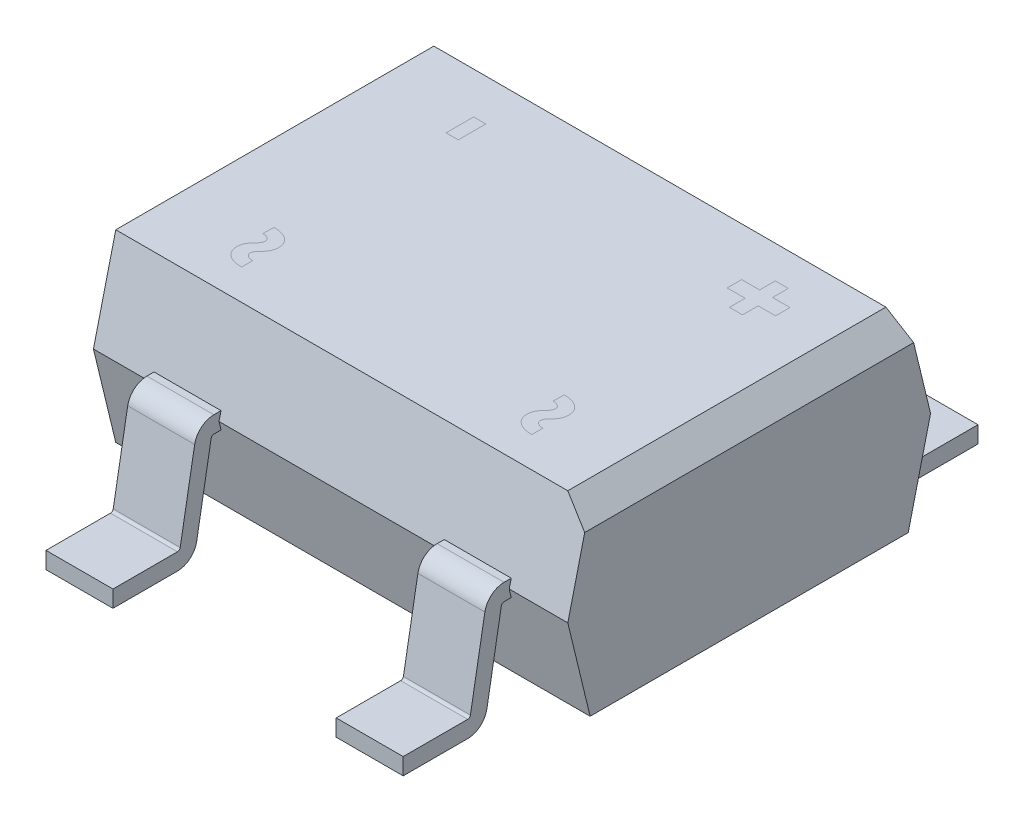
from build123d import *

# Parameters (mm, degrees)
BOSS_EXTRUDE1_DEPTH = 4.25
CHAMFER1_SIZE       = 0.4
BOSS_EXTRUDE2_DEPTH = 0.6
LPATTERN1_COUNT     = 2
LPATTERN1_PITCH     = 5.2


with BuildPart() as part:
    # Sketch1 → Boss-Extrude1 (new, symmetric)
    with BuildSketch(Plane(origin=(0, 0, 0), x_dir=(0, 0, -1), z_dir=(1, 0, 0))):
        Polygon((2.85, 0.3), (-2.85, 0.3), (-3.25, 1.95), (-2.85, 3.6), (2.85, 3.6), (3.25, 1.95), align=None)
    extrude(amount=BOSS_EXTRUDE1_DEPTH, both=True)

    # Chamfer1
    chamfer1_edges = [part.edges().sort_by_distance(p)[0] for p in [
        (4.25, 3.6, 0),
    ]]
    chamfer(chamfer1_edges, length=CHAMFER1_SIZE)


with BuildPart() as body_2:
    # Sketch2 → Boss-Extrude2 (new, symmetric)
    with BuildSketch(Plane(origin=(2.6, 0, 0), x_dir=(0, 0, -1), z_dir=(1, 0, 0))):
        with BuildLine():
            Line((5.15, 0), (3.994682714, 0))
            ThreePointArc((3.994682714, 0), (3.76970705, 0.081884445), (3.65, 0.289223138))
            Line((3.65, 0.289223138), (3.390894683, 1.758682409))
            ThreePointArc((3.390894683, 1.758682409), (3.373793676, 1.788302222), (3.341654296, 1.8))
            Line((3.341654296, 1.8), (2.841654296, 1.8))
            Line((2.841654296, 1.8), (2.841654296, 2.1))
            Line((2.841654296, 2.1), (3.341654296, 2.1))
            ThreePointArc((3.341654296, 2.1), (3.566629959, 2.018115555), (3.686337009, 1.810776862))
            Line((3.686337009, 1.810776862), (3.945442326, 0.341317591))
            ThreePointArc((3.945442326, 0.341317591), (3.962543333, 0.311697778), (3.994682714, 0.3))
            Line((3.994682714, 0.3), (5.15, 0.3))
            Line((5.15, 0.3), (5.15, 0))
        make_face()
    boss_extrude2 = extrude(amount=BOSS_EXTRUDE2_DEPTH, both=True)


with BuildPart() as lpattern1_1:
    # LPattern1: Boss-Extrude2 ×2
    with Locations(*[(-i * LPATTERN1_PITCH, 0, 0) for i in range(1, LPATTERN1_COUNT)]):
        add(boss_extrude2)


with BuildPart() as body_4:
    # Mirror2: mirrored copy
    add(body_2.part.mirror(Plane.XY))


with BuildPart() as body_5:
    # Mirror2 2: mirrored copy
    add(lpattern1_1.part.mirror(Plane.XY))


solid = Compound([part.part, body_2.part, lpattern1_1.part, body_4.part, body_5.part])
